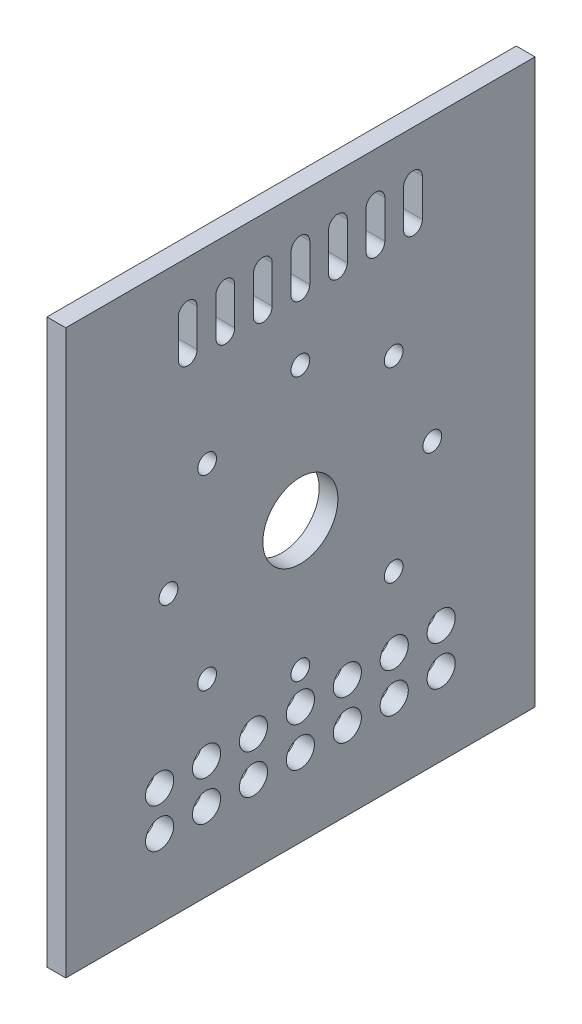
from build123d import *

# Parameters (mm, degrees)
SKETCH_1_W      = 250
SKETCH_1_H      = 300
SKETCH_1_R      = 20
SKETCH_1_R_2    = 7.5
SKETCH_1_R_3    = 5
EXTRUDE_2_DEPTH = 10


with BuildPart() as part:
    # 草图1 → 凸台-拉伸2 (new body)
    with BuildSketch(Plane(origin=(0, 0, 0), x_dir=(0, 0, -1), z_dir=(1, 0, 0))):
        Rectangle(SKETCH_1_W, SKETCH_1_H)
        with Locations((0, -1.426013128)):
            Circle(SKETCH_1_R, mode=Mode.SUBTRACT)
        with Locations((0, -87.366817617)):
            Circle(SKETCH_1_R_2, mode=Mode.SUBTRACT)
        with Locations((0, 70.265)):
            Circle(SKETCH_1_R_3, mode=Mode.SUBTRACT)
        with Locations((49.68485798, 49.68485798)):
            Circle(SKETCH_1_R_3, mode=Mode.SUBTRACT)
        with Locations((70.265, 0)):
            Circle(SKETCH_1_R_3, mode=Mode.SUBTRACT)
        with Locations((49.68485798, -49.68485798)):
            Circle(SKETCH_1_R_3, mode=Mode.SUBTRACT)
        with Locations((0, -70.265)):
            Circle(SKETCH_1_R_3, mode=Mode.SUBTRACT)
        with Locations((-49.68485798, -49.68485798)):
            Circle(SKETCH_1_R_3, mode=Mode.SUBTRACT)
        with Locations((-70.265, 0)):
            Circle(SKETCH_1_R_3, mode=Mode.SUBTRACT)
        with Locations((-49.68485798, 49.68485798)):
            Circle(SKETCH_1_R_3, mode=Mode.SUBTRACT)
        with Locations((0, -108.413247163)):
            Circle(SKETCH_1_R_2, mode=Mode.SUBTRACT)
        with Locations((25, -87.366817617)):
            Circle(SKETCH_1_R_2, mode=Mode.SUBTRACT)
        with Locations((25, -108.413247163)):
            Circle(SKETCH_1_R_2, mode=Mode.SUBTRACT)
        with Locations((50, -87.366817617)):
            Circle(SKETCH_1_R_2, mode=Mode.SUBTRACT)
        with Locations((50, -108.413247163)):
            Circle(SKETCH_1_R_2, mode=Mode.SUBTRACT)
        with Locations((75, -87.366817617)):
            Circle(SKETCH_1_R_2, mode=Mode.SUBTRACT)
        with Locations((75, -108.413247163)):
            Circle(SKETCH_1_R_2, mode=Mode.SUBTRACT)
        with Locations((-25, -87.366817617)):
            Circle(SKETCH_1_R_2, mode=Mode.SUBTRACT)
        with Locations((-25, -108.413247163)):
            Circle(SKETCH_1_R_2, mode=Mode.SUBTRACT)
        with Locations((-50, -87.366817617)):
            Circle(SKETCH_1_R_2, mode=Mode.SUBTRACT)
        with Locations((-50, -108.413247163)):
            Circle(SKETCH_1_R_2, mode=Mode.SUBTRACT)
        with Locations((-75, -87.366817617)):
            Circle(SKETCH_1_R_2, mode=Mode.SUBTRACT)
        with Locations((-75, -108.413247163)):
            Circle(SKETCH_1_R_2, mode=Mode.SUBTRACT)
        with BuildLine():
            Line((5, 125), (5, 105))
            ThreePointArc((5, 105), (0, 100), (-5, 105))
            Line((-5, 105), (-5, 125))
            ThreePointArc((-5, 125), (0, 130), (5, 125))
        make_face(mode=Mode.SUBTRACT)
        with BuildLine():
            Line((25, 125), (25, 105))
            ThreePointArc((25, 105), (20, 100), (15, 105))
            Line((15, 105), (15, 125))
            ThreePointArc((15, 125), (20, 130), (25, 125))
        make_face(mode=Mode.SUBTRACT)
        with BuildLine():
            Line((45, 125), (45, 105))
            ThreePointArc((45, 105), (40, 100), (35, 105))
            Line((35, 105), (35, 125))
            ThreePointArc((35, 125), (40, 130), (45, 125))
        make_face(mode=Mode.SUBTRACT)
        with BuildLine():
            Line((65, 125), (65, 105))
            ThreePointArc((65, 105), (60, 100), (55, 105))
            Line((55, 105), (55, 125))
            ThreePointArc((55, 125), (60, 130), (65, 125))
        make_face(mode=Mode.SUBTRACT)
        with BuildLine():
            Line((-15, 125), (-15, 105))
            ThreePointArc((-15, 105), (-20, 100), (-25, 105))
            Line((-25, 105), (-25, 125))
            ThreePointArc((-25, 125), (-20, 130), (-15, 125))
        make_face(mode=Mode.SUBTRACT)
        with BuildLine():
            Line((-35, 125), (-35, 105))
            ThreePointArc((-35, 105), (-40, 100), (-45, 105))
            Line((-45, 105), (-45, 125))
            ThreePointArc((-45, 125), (-40, 130), (-35, 125))
        make_face(mode=Mode.SUBTRACT)
        with BuildLine():
            Line((-55, 125), (-55, 105))
            ThreePointArc((-55, 105), (-60, 100), (-65, 105))
            Line((-65, 105), (-65, 125))
            ThreePointArc((-65, 125), (-60, 130), (-55, 125))
        make_face(mode=Mode.SUBTRACT)
    extrude(amount=EXTRUDE_2_DEPTH)


solid = part.part
